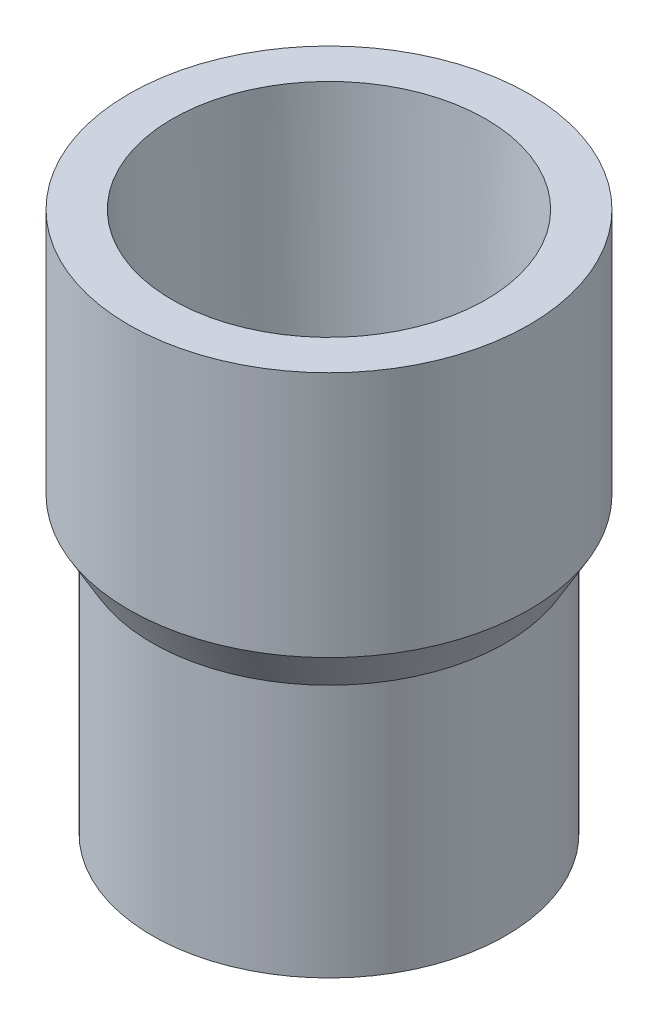
from build123d import *


with BuildPart() as part:
    # Sketch1 → Revolve1 (revolve)
    with BuildSketch(Plane.XY, mode=Mode.PRIVATE) as revolve1_sk:
        Polygon((9.8, 0.715177656), (10.25, -14.284822344), (13.25, -14.284822344), (13.25, 4.718730462), (15, 7.749819375), (15, 26.24266131), (11.75, 26.24266131), (11, 6.24266131), (11, 1.24266131), (9.8, 1.24266131), align=None)
    revolve(revolve1_sk.sketch.rotate(Axis((0, 0, 0), (0, 1, 0)), 90), axis=Axis((0, 0, 0), (0, 1, 0)))


solid = part.part
